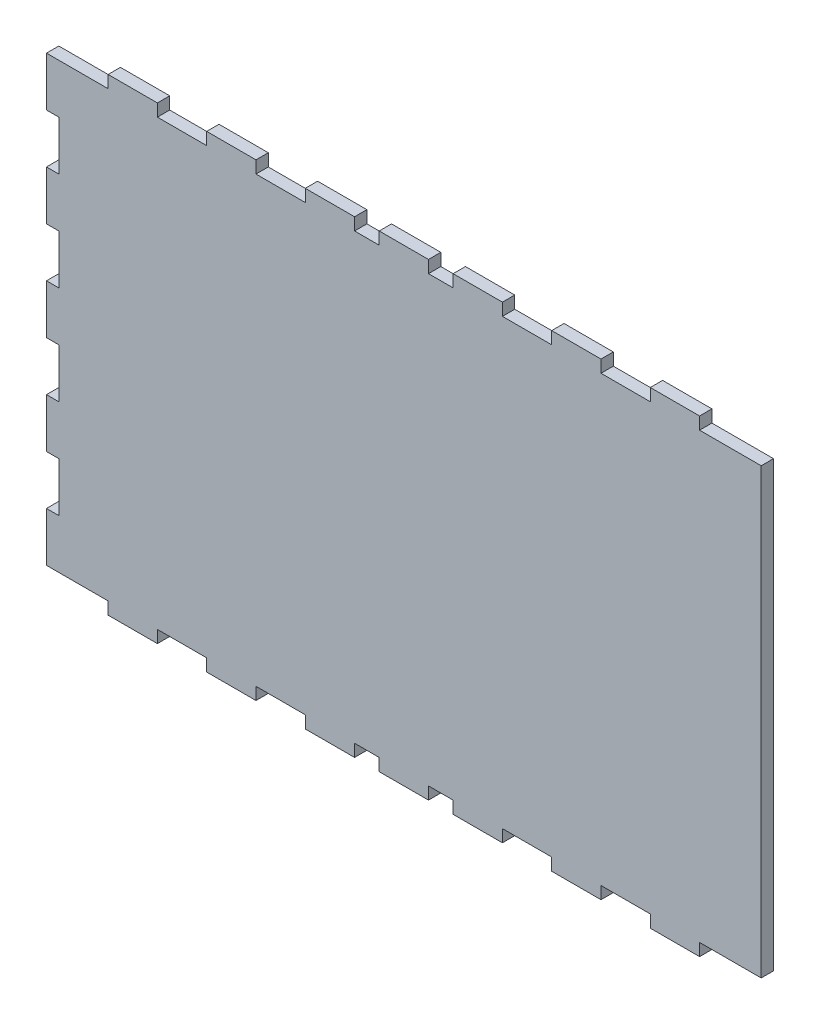
from build123d import *

# Parameters (mm, degrees)
EXTRUDE1_DEPTH = 6.35


with BuildPart() as part:
    # Sketch1 → Extrude1 (new body)
    with BuildSketch(Plane.XY):
        Polygon((132.515587146, 19.289172699), (164.265587146, 19.289172699), (164.265587146, 25.639172699), (189.665587146, 25.639172699), (189.665587146, 19.289172699), (215.065587146, 19.289172699), (215.065587146, 25.639172699), (240.465587146, 25.639172699), (240.465587146, 19.289172699), (265.865587146, 19.289172699), (265.865587146, 25.639172699), (291.265587146, 25.639172699), (291.265587146, 19.289172699), (303.965587146, 19.289172699), (303.965587146, 25.639172699), (329.365587146, 25.639172699), (329.365587146, 19.289172699), (342.065587146, 19.289172699), (342.065587146, 25.639172699), (367.465587146, 25.639172699), (367.465587146, 19.289172699), (392.865587146, 19.289172699), (392.865587146, 25.639172699), (418.265587146, 25.639172699), (418.265587146, 19.289172699), (443.665587146, 19.289172699), (443.665587146, 25.639172699), (469.065587146, 25.639172699), (469.065587146, 19.289172699), (500.815587146, 19.289172699), (500.815587146, -209.310827301), (469.065587146, -209.310827301), (469.065587146, -215.660827301), (443.665587146, -215.660827301), (443.665587146, -209.310827301), (418.265587146, -209.310827301), (418.265587146, -215.660827301), (392.865587146, -215.660827301), (392.865587146, -209.310827301), (367.465587146, -209.310827301), (367.465587146, -215.660827301), (342.065587146, -215.660827301), (342.065587146, -209.310827301), (329.365587146, -209.310827301), (329.365587146, -215.660827301), (303.965587146, -215.660827301), (303.965587146, -209.310827301), (291.265587146, -209.310827301), (291.265587146, -215.660827301), (265.865587146, -215.660827301), (265.865587146, -209.310827301), (240.465587146, -209.310827301), (240.465587146, -215.660827301), (215.065587146, -215.660827301), (215.065587146, -209.310827301), (189.665587146, -209.310827301), (189.665587146, -215.660827301), (164.265587146, -215.660827301), (164.265587146, -209.310827301), (132.515587146, -209.310827301), (132.515587146, -183.910827301), (138.865587146, -183.910827301), (138.865587146, -158.510827301), (132.515587146, -158.510827301), (132.515587146, -133.110827301), (138.865587146, -133.110827301), (138.865587146, -107.710827301), (132.515587146, -107.710827301), (132.515587146, -82.310827301), (138.865587146, -82.310827301), (138.865587146, -56.910827301), (132.515587146, -56.910827301), (132.515587146, -31.510827301), (138.865587146, -31.510827301), (138.865587146, -6.110827301), (132.515587146, -6.110827301), align=None)
    extrude(amount=EXTRUDE1_DEPTH)


solid = part.part
